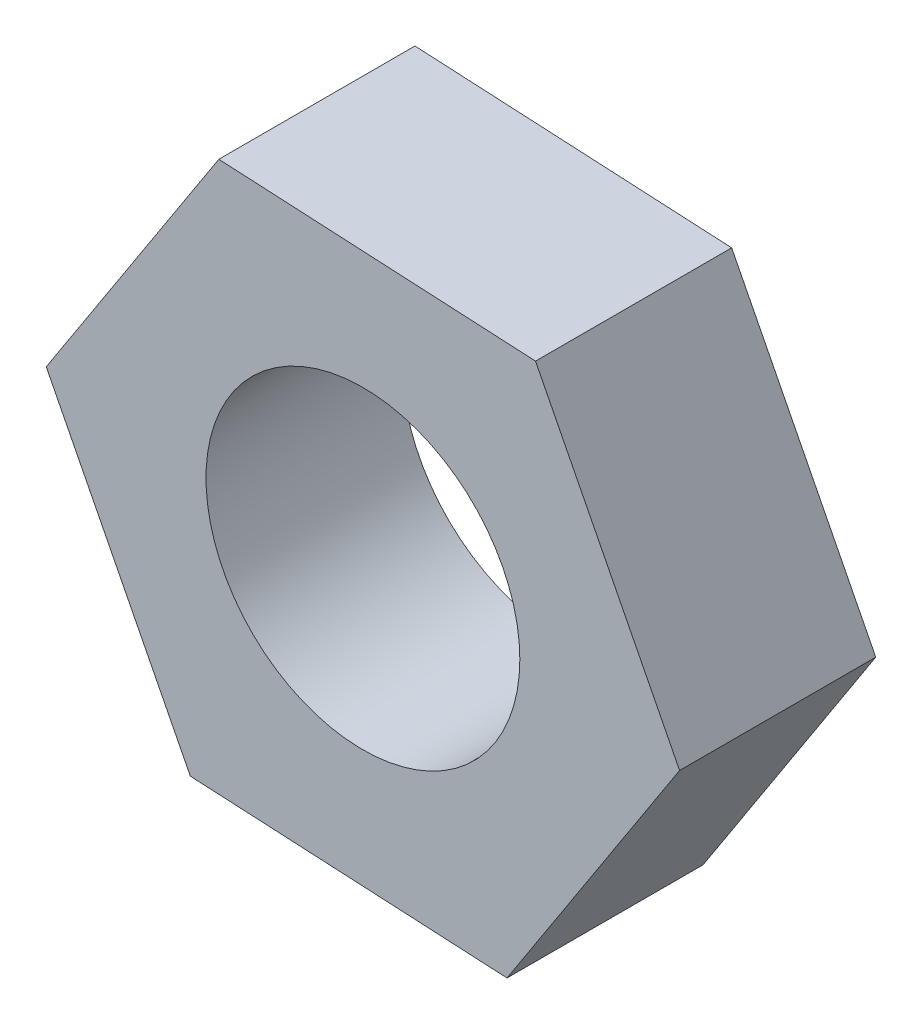
from build123d import *

# Parameters (mm, degrees)
EXTRUDE_213_DEPTH   = 2.5
SKETCH_2_R          = 2
CUT_EXTRUDE_1_DEPTH = 6.958223432


with BuildPart() as part:
    # Эскиз1 → Extrude 213 (new body)
    with BuildSketch(Plane.XY):
        Polygon((2.199636774, 3.390417584), (-1.83636937, 3.600150118), (-4.036006144, 0.209732533), (-2.199636774, -3.390417584), (1.83636937, -3.600150118), (4.036006144, -0.209732533), align=None)
    extrude(amount=EXTRUDE_213_DEPTH)

    # Эскиз2 → Вырез-Вытянуть1 (cut, through all)
    with BuildSketch(Plane.XY.offset(2.5)):
        Circle(SKETCH_2_R)
    extrude(amount=-CUT_EXTRUDE_1_DEPTH, mode=Mode.SUBTRACT)


solid = part.part
